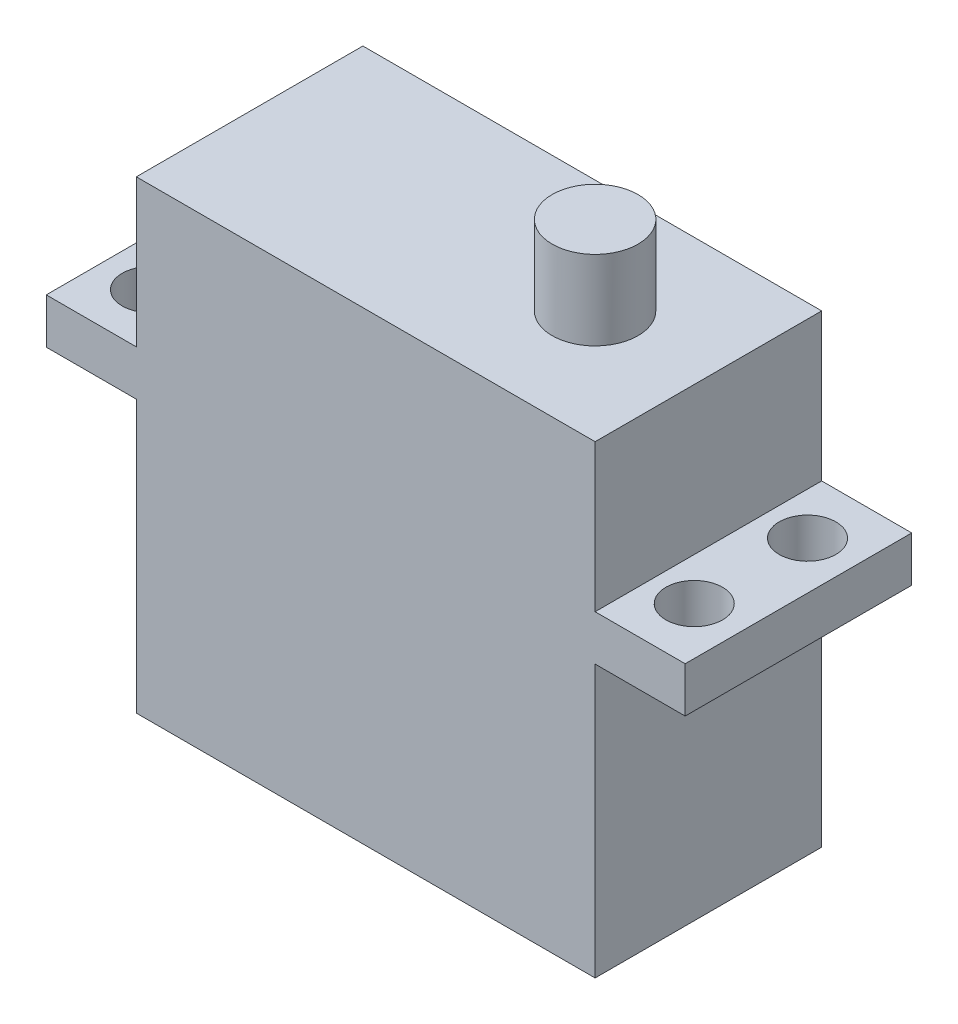
from build123d import *

# Parameters (mm, degrees)
SKETCH2_W           = 40.5
SKETCH2_H           = 41
BOSS_EXTRUDE1_DEPTH = 20
SKETCH4_W           = 20
SKETCH4_H           = 4
BOSS_EXTRUDE2_DEPTH = 7.95
SKETCH5_W           = 20
SKETCH5_H           = 4
BOSS_EXTRUDE3_DEPTH = 7.95
SKETCH8_R           = 2.5
CUT_EXTRUDE1_DEPTH  = 45.488650238
SKETCH11_R          = 3.792509707
BOSS_EXTRUDE4_DEPTH = 7


with BuildPart() as part:
    # Sketch2 → Boss-Extrude1 (new body)
    with BuildSketch(Plane.XY):
        Rectangle(SKETCH2_W, SKETCH2_H)
    extrude(amount=BOSS_EXTRUDE1_DEPTH)

    # Sketch4 → Boss-Extrude2 (add)
    with BuildSketch(Plane(origin=(20.25, 0, 0), x_dir=(0, 0, -1), z_dir=(1, 0, 0))):
        with Locations((-10, 5.5)):
            Rectangle(SKETCH4_W, SKETCH4_H)
    extrude(amount=BOSS_EXTRUDE2_DEPTH)

    # Sketch5 → Boss-Extrude3 (add)
    with BuildSketch(Plane.ZY.offset(20.25)):
        with Locations((10, 5.5)):
            Rectangle(SKETCH5_W, SKETCH5_H)
    extrude(amount=BOSS_EXTRUDE3_DEPTH)

    # Sketch8 → Cut-Extrude1 (cut, through all)
    with BuildSketch(Plane(origin=(0, 7.5, 0), x_dir=(1, 0, 0), z_dir=(0, 1, 0))):
        with Locations(Location((24, -5, 0), (0, 0, 270))):
            Circle(SKETCH8_R)
        with Locations(Location((24, -15, 0), (0, 0, 270))):
            Circle(SKETCH8_R)
        with Locations(Location((-24, -5, 0), (0, 0, 270))):
            Circle(SKETCH8_R)
        with Locations(Location((-24, -15, 0), (0, 0, 270))):
            Circle(SKETCH8_R)
    extrude(amount=-CUT_EXTRUDE1_DEPTH, mode=Mode.SUBTRACT)

    # Sketch11 → Boss-Extrude4 (add)
    with BuildSketch(Plane(origin=(0, 20.5, 0), x_dir=(1, 0, 0), z_dir=(0, 1, 0))):
        with Locations(Location((10.25, -10, 0), (0, 0, 90))):
            Circle(SKETCH11_R)
    extrude(amount=BOSS_EXTRUDE4_DEPTH)


solid = part.part
